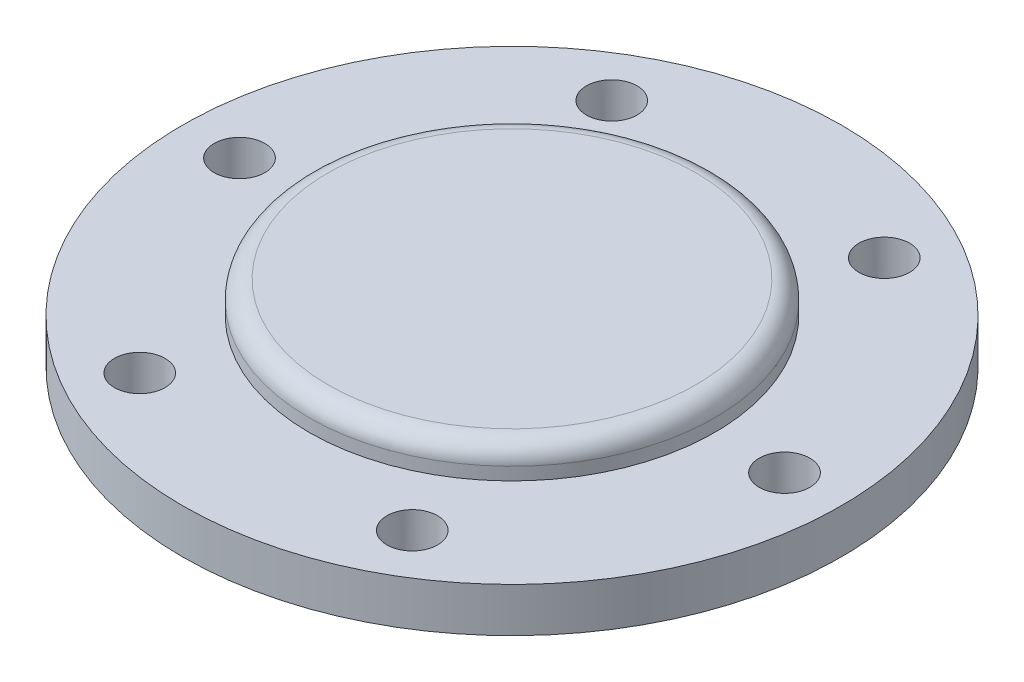
from build123d import *

# Parameters (mm, degrees)
CUT_EXTRUDE1_DEPTH      = 37.935755035
CUT_EXTRUDE1_DEPTH_BACK = 37.935755035
SKETCH2_R               = 2
FILLET1_R               = 1.5


with BuildPart() as part:
    # Sketch1 → Revolve1 (revolve)
    with BuildSketch(Plane.XY, mode=Mode.PRIVATE) as revolve1_sk:
        Polygon((0, 3.5), (16, 3.5), (16, 1), (26, 1), (26, -2.5), (15, -2.5), (15, -3.5), (0, -3.5), align=None)
    revolve(revolve1_sk.sketch.rotate(Axis((0, 3.5, 0), (0, -1, 0)), 90), axis=Axis((0, 3.5, 0), (0, -1, 0)))

    # Sketch2 → Cut-Extrude1 (cut, two sides: drawn at the far end of the back side and taken through both)
    with BuildSketch(Plane(origin=(0, 0, 0), x_dir=(1, 0, 0), z_dir=(0, 1, 0)).offset(-CUT_EXTRUDE1_DEPTH_BACK)):
        with Locations(Location((-21.5, 0, 0), (0, 0, 270))):
            Circle(SKETCH2_R)
        with Locations(Location((-10.75, -18.619546181, 0), (0, 0, 270))):
            Circle(SKETCH2_R)
        with Locations(Location((10.75, -18.619546181, 0), (0, 0, 270))):
            Circle(SKETCH2_R)
        with Locations(Location((21.5, 0, 0), (0, 0, 270))):
            Circle(SKETCH2_R)
        with Locations(Location((10.75, 18.619546181, 0), (0, 0, 270))):
            Circle(SKETCH2_R)
        with Locations(Location((-10.75, 18.619546181, 0), (0, 0, 270))):
            Circle(SKETCH2_R)
    extrude(amount=CUT_EXTRUDE1_DEPTH + CUT_EXTRUDE1_DEPTH_BACK, mode=Mode.SUBTRACT)

    # Fillet1
    fillet1_edges = [part.edges().sort_by_distance(p)[0] for p in [
        (0, 3.5, -16),
    ]]
    fillet(fillet1_edges, radius=FILLET1_R)


solid = part.part
